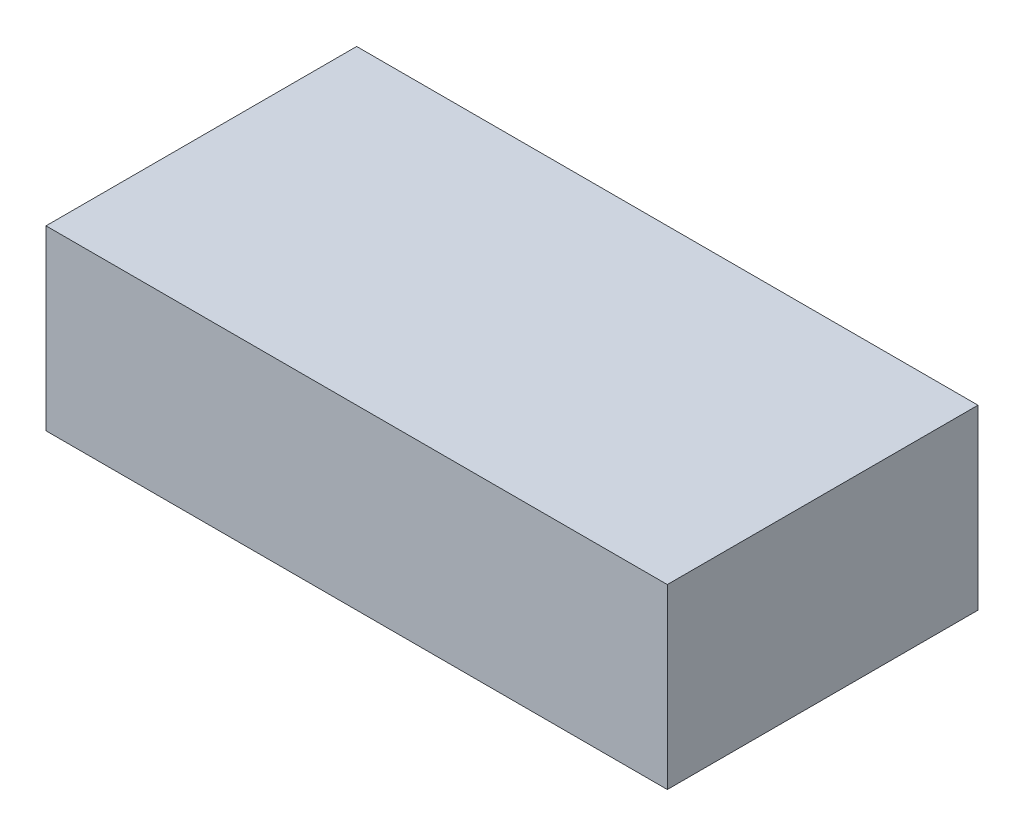
from build123d import *

# Parameters (mm, degrees)
SKETCH1_W           = 70
SKETCH1_H           = 35
BOSS_EXTRUDE1_DEPTH = 20


with BuildPart() as part:
    # Sketch1 → Boss-Extrude1 (new body)
    with BuildSketch(Plane(origin=(0, 0, 0), x_dir=(1, 0, 0), z_dir=(0, 1, 0))):
        with Locations((35, 17.5)):
            Rectangle(SKETCH1_W, SKETCH1_H)
    extrude(amount=BOSS_EXTRUDE1_DEPTH)


solid = part.part
